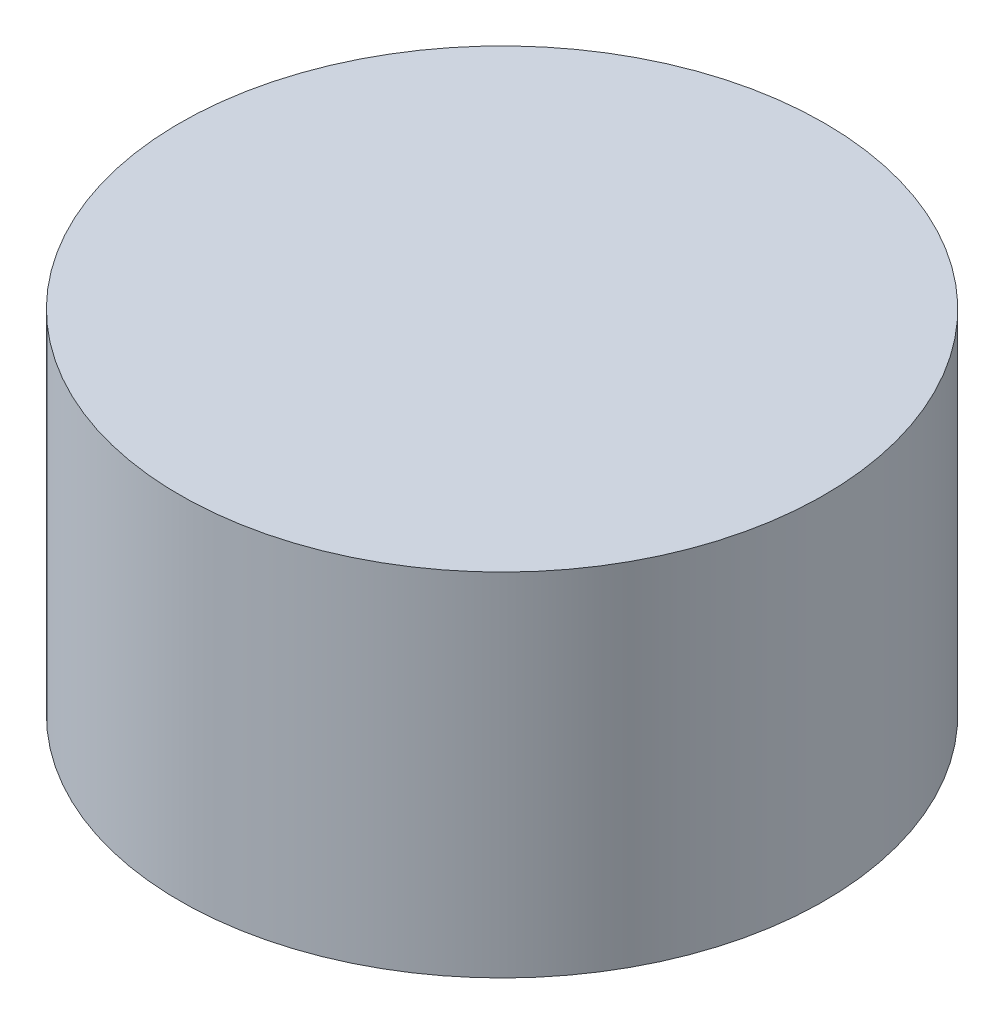
from build123d import *

# Parameters (mm, degrees)
SKETCH2_W          = 55
SKETCH2_H          = 60
SKETCH3_R          = 50
CUT_EXTRUDE1_DEPTH = 55
CUT_EXTRUDE2_DEPTH = 55
SKETCH6_R          = 1.998127765
CUT_EXTRUDE3_DEPTH = 5


with BuildPart() as part:
    # Sketch2 → Revolve1 (revolve)
    with BuildSketch(Plane.XY, mode=Mode.PRIVATE) as revolve1_sk:
        with Locations((-62.704631046, 58.675948718)):
            Rectangle(SKETCH2_W, SKETCH2_H)
    revolve(revolve1_sk.sketch.rotate(Axis((-35.204631046, 28.675948718, 0), (0, 1, 0)), 270), axis=Axis((-35.204631046, 28.675948718, 0), (0, 1, 0)))

    # Sketch3 → Cut-Extrude1 (cut)
    with BuildSketch(Plane.XZ.offset(-28.675948718)):
        with Locations(Location((-35.204631046, 0, 0), (0, 0, 270))):
            Circle(SKETCH3_R)
    extrude(amount=-CUT_EXTRUDE1_DEPTH, mode=Mode.SUBTRACT)

    # Sketch5 → Cut-Extrude2 (cut)
    with BuildSketch(Plane(origin=(-95, 0, 0), x_dir=(0, 0, -1), z_dir=(1, 0, 0))):
        Polygon((3.193764138, 58.175948718), (7.693764138, 58.175948718), (7.693764138, 67.175948718), (-1.306235862, 67.175948718), (-1.306235862, 58.175948718), align=None)
    extrude(amount=CUT_EXTRUDE2_DEPTH, mode=Mode.SUBTRACT)

    # Sketch6 → Cut-Extrude3 (cut)
    with BuildSketch(Plane(origin=(0, 28.675948718, 0), x_dir=(-1, 0, 0), z_dir=(0, -1, 0))):
        with Locations(Location((35.204631046, -52.509597986, 0), (0, 0, 90))):
            Circle(SKETCH6_R)
        with Locations(Location((-17.304966941, 0, 0), (0, 0, 90))):
            Circle(SKETCH6_R)
        with Locations(Location((35.204631046, 52.509597986, 0), (0, 0, 90))):
            Circle(SKETCH6_R)
        with Locations(Location((87.714229032, 0, 0), (0, 0, 90))):
            Circle(SKETCH6_R)
    extrude(amount=-CUT_EXTRUDE3_DEPTH, mode=Mode.SUBTRACT)


solid = part.part
